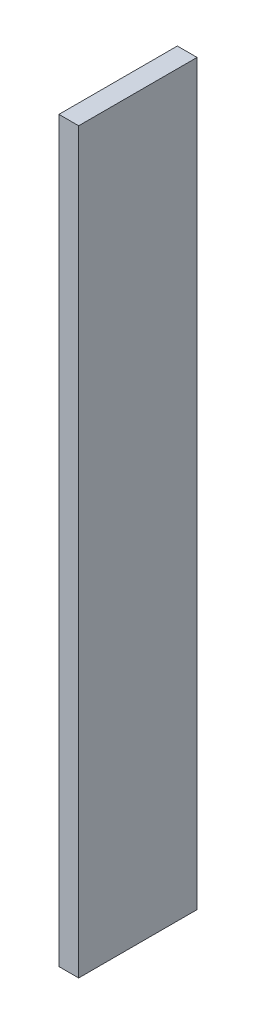
from build123d import *

# Parameters (mm, degrees)
SKETCH_1_W      = 5
SKETCH_1_H      = 30
EXTRUDE_1_DEPTH = 187


with BuildPart() as part:
    # Эскиз1 → Бобышка-Вытянуть1 (new body)
    with BuildSketch(Plane(origin=(0, 0, 0), x_dir=(1, 0, 0), z_dir=(0, 1, 0))):
        with Locations((2.5, -15)):
            Rectangle(SKETCH_1_W, SKETCH_1_H)
    extrude(amount=EXTRUDE_1_DEPTH)


solid = part.part
